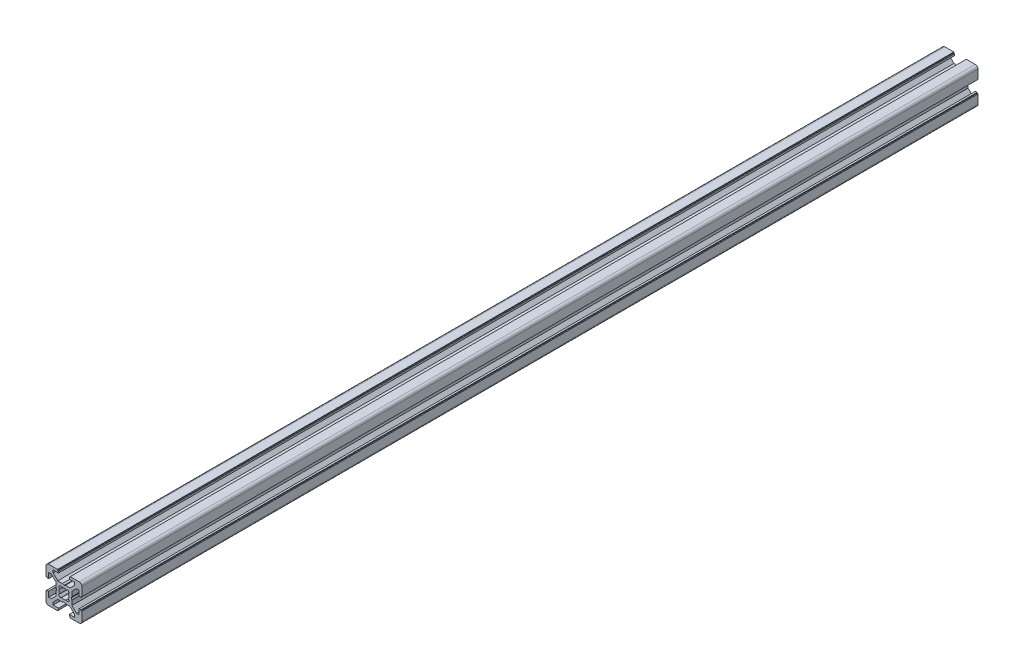
from build123d import *

# Parameters (mm, degrees)
BOSS_EXTRU_1_DEPTH      = 500
ENL_V_MAT_EXTRU_1_DEPTH = 501.199960016


with BuildPart() as part:
    # Esquisse1 → Boss.-Extru.1 (new body)
    with BuildSketch(Plane.XY):
        with BuildLine():
            Line((-4, 0), (-4.5, 0.866025404))
            Line((-4.5, 0.866025404), (-4.5, 3.439339828))
            Line((-4.5, 3.439339828), (-7.060660172, 6))
            Line((-7.060660172, 6), (-8.5, 6))
            Line((-8.5, 6), (-8.5, 3))
            Line((-8.5, 3), (-9.5, 3))
            Line((-9.5, 3), (-9.5, 3.5))
            Line((-9.5, 3.5), (-10, 3.5))
            Line((-10, 3.5), (-10, 8.5))
            ThreePointArc((-10, 8.5), (-9.560660172, 9.560660172), (-8.5, 10))
            Line((-8.5, 10), (-3.5, 10))
            Line((-3.5, 10), (-3.5, 9.5))
            Line((-3.5, 9.5), (-3, 9.5))
            Line((-3, 9.5), (-3, 8.5))
            Line((-3, 8.5), (-6, 8.5))
            Line((-6, 8.5), (-6, 7.060660172))
            Line((-6, 7.060660172), (-3.439339828, 4.5))
            Line((-3.439339828, 4.5), (-0.866025404, 4.5))
            Line((-0.866025404, 4.5), (0, 4))
            Line((0, 4), (0.866025404, 4.5))
            Line((0.866025404, 4.5), (3.439339828, 4.5))
            Line((3.439339828, 4.5), (6, 7.060660172))
            Line((6, 7.060660172), (6, 8.5))
            Line((6, 8.5), (3, 8.5))
            Line((3, 8.5), (3, 9.5))
            Line((3, 9.5), (3.5, 9.5))
            Line((3.5, 9.5), (3.5, 10))
            Line((3.5, 10), (8.5, 10))
            ThreePointArc((8.5, 10), (9.560660172, 9.560660172), (10, 8.5))
            Line((10, 8.5), (10, 3.5))
            Line((10, 3.5), (9.5, 3.5))
            Line((9.5, 3.5), (9.5, 3))
            Line((9.5, 3), (8.5, 3))
            Line((8.5, 3), (8.5, 6))
            Line((8.5, 6), (7.060660172, 6))
            Line((7.060660172, 6), (4.5, 3.439339828))
            Line((4.5, 3.439339828), (4.5, 0.866025404))
            Line((4.5, 0.866025404), (4, 0))
            Line((4, 0), (4.5, -0.866025404))
            Line((4.5, -0.866025404), (4.5, -3.439339828))
            Line((4.5, -3.439339828), (7.060660172, -6))
            Line((7.060660172, -6), (8.5, -6))
            Line((8.5, -6), (8.5, -3))
            Line((8.5, -3), (9.5, -3))
            Line((9.5, -3), (9.5, -3.5))
            Line((9.5, -3.5), (10, -3.5))
            Line((10, -3.5), (10, -8.5))
            ThreePointArc((10, -8.5), (9.560660172, -9.560660172), (8.5, -10))
            Line((8.5, -10), (3.5, -10))
            Line((3.5, -10), (3.5, -9.5))
            Line((3.5, -9.5), (3, -9.5))
            Line((3, -9.5), (3, -8.5))
            Line((3, -8.5), (6, -8.5))
            Line((6, -8.5), (6, -7.060660172))
            Line((6, -7.060660172), (3.439339828, -4.5))
            Line((3.439339828, -4.5), (0.866025404, -4.5))
            Line((0.866025404, -4.5), (0, -4))
            Line((0, -4), (-0.866025404, -4.5))
            Line((-0.866025404, -4.5), (-3.439339828, -4.5))
            Line((-3.439339828, -4.5), (-6, -7.060660172))
            Line((-6, -7.060660172), (-6, -8.5))
            Line((-6, -8.5), (-3, -8.5))
            Line((-3, -8.5), (-3, -9.5))
            Line((-3, -9.5), (-3.5, -9.5))
            Line((-3.5, -9.5), (-3.5, -10))
            Line((-3.5, -10), (-8.5, -10))
            ThreePointArc((-8.5, -10), (-9.560660172, -9.560660172), (-10, -8.5))
            Line((-10, -8.5), (-10, -3.5))
            Line((-10, -3.5), (-9.5, -3.5))
            Line((-9.5, -3.5), (-9.5, -3))
            Line((-9.5, -3), (-8.5, -3))
            Line((-8.5, -3), (-8.5, -6))
            Line((-8.5, -6), (-7.060660172, -6))
            Line((-7.060660172, -6), (-4.5, -3.439339828))
            Line((-4.5, -3.439339828), (-4.5, -0.866025404))
            Line((-4.5, -0.866025404), (-4, 0))
        make_face()
    extrude(amount=-BOSS_EXTRU_1_DEPTH)

    # Esquisse2 → Enlèv. mat.-Extru.1 (cut, through all)
    with BuildSketch(Plane.XY):
        with BuildLine():
            Line((1.949592103, 3.000876196), (1.276279893, 2.435900169))
            ThreePointArc((1.276279893, 2.435900169), (0.001756003, 2.749999439), (-1.273167982, 2.43752811))
            Line((-1.273167982, 2.43752811), (-1.947287092, 3.003181207))
            Line((-1.947287092, 3.003181207), (-3.000876196, 1.949592103))
            Line((-3.000876196, 1.949592103), (-2.435900169, 1.276279893))
            ThreePointArc((-2.435900169, 1.276279893), (-2.749999439, 0.001756003), (-2.43752811, -1.273167982))
            Line((-2.43752811, -1.273167982), (-3.003181207, -1.947287092))
            Line((-3.003181207, -1.947287092), (-1.949592103, -3.000876196))
            Line((-1.949592103, -3.000876196), (-1.276279893, -2.435900169))
            ThreePointArc((-1.276279893, -2.435900169), (-0.001756003, -2.749999439), (1.273167982, -2.43752811))
            Line((1.273167982, -2.43752811), (1.947287092, -3.003181207))
            Line((1.947287092, -3.003181207), (3.000876196, -1.949592103))
            Line((3.000876196, -1.949592103), (2.435900169, -1.276279893))
            ThreePointArc((2.435900169, -1.276279893), (2.749999439, -0.001756003), (2.43752811, 1.273167982))
            Line((2.43752811, 1.273167982), (3.003181207, 1.947287092))
            Line((3.003181207, 1.947287092), (1.949592103, 3.000876196))
        make_face()
    extrude(amount=-ENL_V_MAT_EXTRU_1_DEPTH, mode=Mode.SUBTRACT)


solid = part.part
